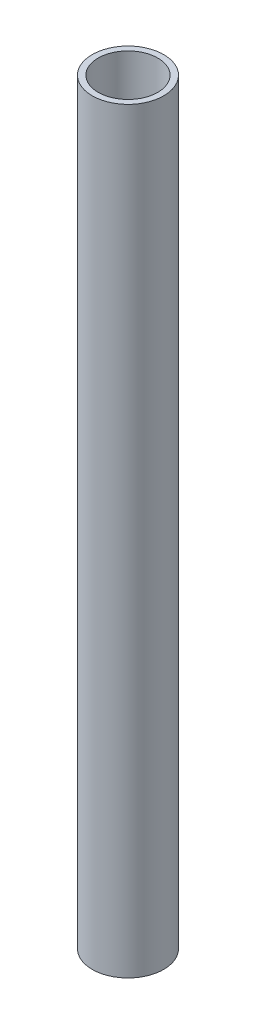
from build123d import *

# Parameters (mm, degrees)
SKETCH1_R           = 6
SKETCH1_R_2         = 5
BOSS_EXTRUDE1_DEPTH = 127


with BuildPart() as part:
    # Sketch1 → Boss-Extrude1 (new body)
    with BuildSketch(Plane(origin=(0, 0, 0), x_dir=(1, 0, 0), z_dir=(0, 1, 0))):
        with Locations(Location((0, 0, 0), (0, 0, 270))):
            Circle(SKETCH1_R)
        with Locations(Location((0, 0, 0), (0, 0, 270))):
            Circle(SKETCH1_R_2, mode=Mode.SUBTRACT)
    extrude(amount=BOSS_EXTRUDE1_DEPTH)


solid = part.part
